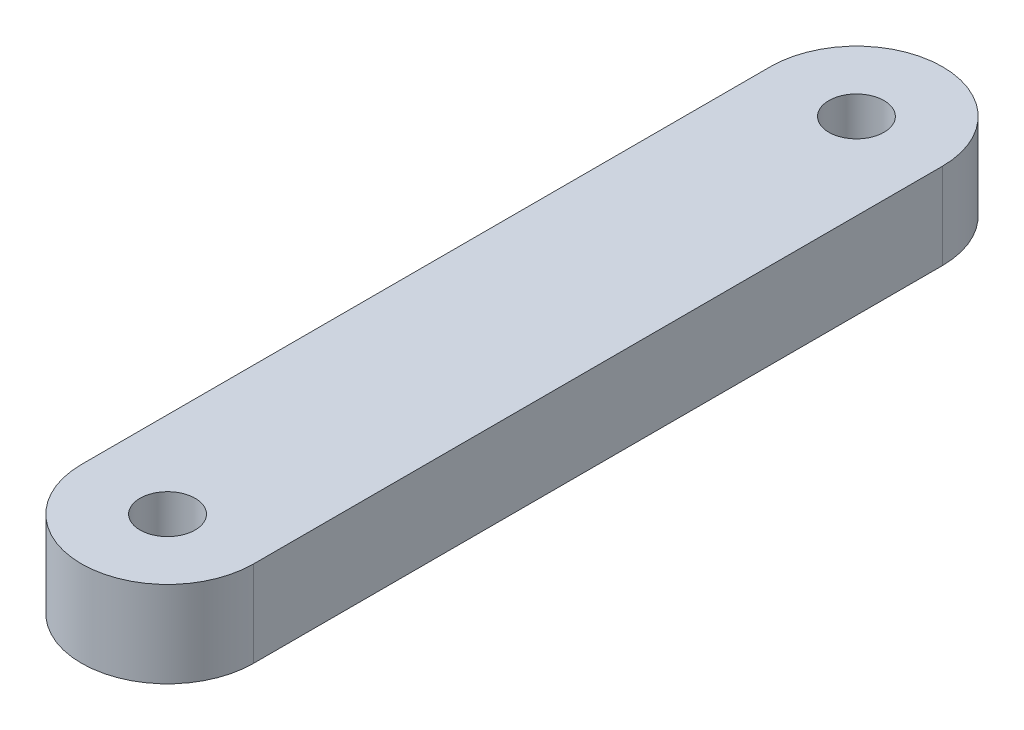
from build123d import *

# Parameters (mm, degrees)
SKETCH1_R           = 1.6
BOSS_EXTRUDE1_DEPTH = 5


with BuildPart() as part:
    # Sketch1 → Boss-Extrude1 (new body)
    with BuildSketch(Plane(origin=(0, 0, 0), x_dir=(1, 0, 0), z_dir=(0, 1, 0))):
        with BuildLine():
            Line((-5, 0), (-5, 40))
            ThreePointArc((-5, 40), (0, 45), (5, 40))
            Line((5, 40), (5, 0))
            ThreePointArc((5, 0), (0, -5), (-5, 0))
        make_face()
        with Locations(Location((0, 40, 0), (0, 0, 270))):
            Circle(SKETCH1_R, mode=Mode.SUBTRACT)
        with Locations(Location((0, 0, 0), (0, 0, 270))):
            Circle(SKETCH1_R, mode=Mode.SUBTRACT)
    extrude(amount=BOSS_EXTRUDE1_DEPTH)


solid = part.part
